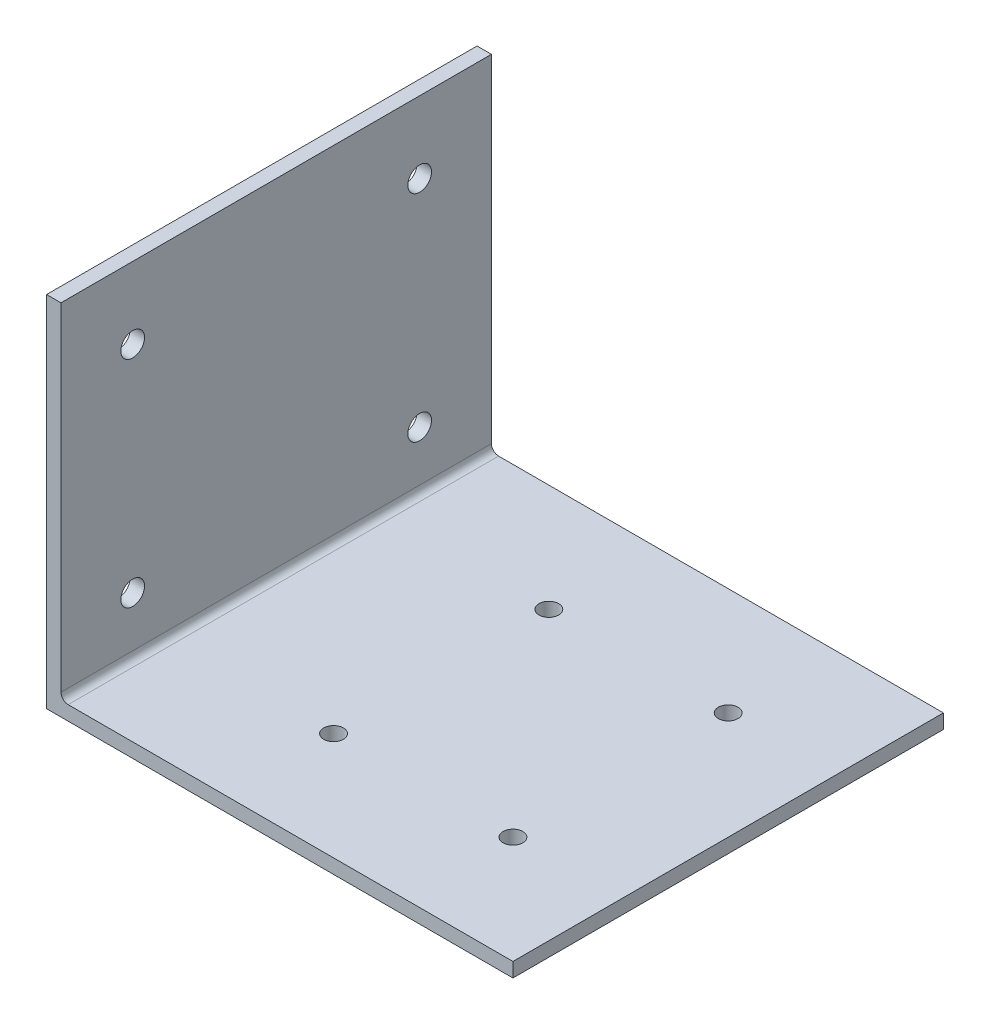
from build123d import *

# Parameters (mm, degrees)
BOSS_EXTRUDE1_DEPTH = 120
SKETCH4_R           = 3.3
CUT_EXTRUDE1_DEPTH  = 201.688813839
SKETCH5_R           = 2.75
CUT_EXTRUDE2_DEPTH  = 202.285866369
FILLET1_R           = 2


with BuildPart() as part:
    # Sketch2 → Boss-Extrude1 (new body)
    with BuildSketch(Plane.XY):
        Polygon((0, 0), (0, 100), (4, 100), (4, 4), (130, 4), (130, 0), align=None)
    extrude(amount=BOSS_EXTRUDE1_DEPTH)

    # Sketch4 → Cut-Extrude1 (cut, through all)
    with BuildSketch(Plane(origin=(4, 0, 0), x_dir=(0, 0, -1), z_dir=(1, 0, 0))):
        with Locations(Location((-100, 80, 0), (0, 0, 90))):
            Circle(SKETCH4_R)
        with Locations(Location((-20, 80, 0), (0, 0, 90))):
            Circle(SKETCH4_R)
        with Locations(Location((-20, 20, 0), (0, 0, 90))):
            Circle(SKETCH4_R)
        with Locations(Location((-100, 20, 0), (0, 0, 90))):
            Circle(SKETCH4_R)
    extrude(amount=-CUT_EXTRUDE1_DEPTH, mode=Mode.SUBTRACT)

    # Sketch5 → Cut-Extrude2 (cut, through all)
    with BuildSketch(Plane(origin=(0, 4, 0), x_dir=(1, 0, 0), z_dir=(0, 1, 0))):
        with Locations(Location((100, -30, 0), (0, 0, 180))):
            Circle(SKETCH5_R)
        with Locations(Location((50, -30, 0), (0, 0, 180))):
            Circle(SKETCH5_R)
        with Locations(Location((50, -90, 0), (0, 0, 180))):
            Circle(SKETCH5_R)
        with Locations(Location((100, -90, 0), (0, 0, 180))):
            Circle(SKETCH5_R)
    extrude(amount=-CUT_EXTRUDE2_DEPTH, mode=Mode.SUBTRACT)

    # Fillet1
    fillet1_edges = [part.edges().sort_by_distance(p)[0] for p in [
        (4, 4, 60),
    ]]
    fillet(fillet1_edges, radius=FILLET1_R)


solid = part.part
